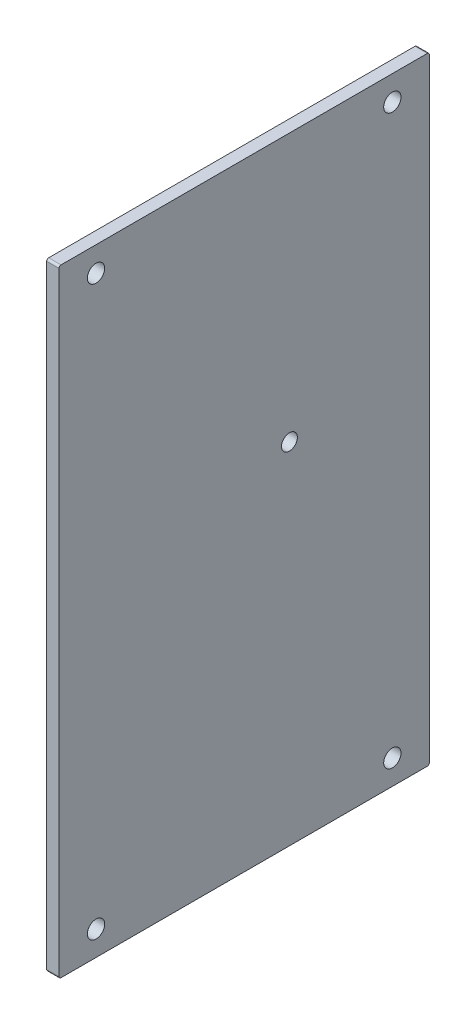
from build123d import *

# Parameters (mm, degrees)
SKETCH1_W           = 90
SKETCH1_H           = 150
SKETCH1_R           = 1.925
SKETCH1_R_2         = 2.1
BOSS_EXTRUDE1_DEPTH = 3
FILLET1_R           = 0.5


with BuildPart() as part:
    # Sketch1 → Boss-Extrude1 (new body)
    with BuildSketch(Plane(origin=(0, 0, 0), x_dir=(0, 0, -1), z_dir=(1, 0, 0))):
        with Locations((45, -75)):
            Rectangle(SKETCH1_W, SKETCH1_H)
        with Locations((56, -65)):
            Circle(SKETCH1_R, mode=Mode.SUBTRACT)
        with Locations((9, -6)):
            Circle(SKETCH1_R_2, mode=Mode.SUBTRACT)
        with Locations(Location((81, -6, 0), (0, 0, 180))):
            Circle(SKETCH1_R_2, mode=Mode.SUBTRACT)
        with Locations((81, -144)):
            Circle(SKETCH1_R_2, mode=Mode.SUBTRACT)
        with Locations(Location((9, -144, 0), (0, 0, 180))):
            Circle(SKETCH1_R_2, mode=Mode.SUBTRACT)
    extrude(amount=BOSS_EXTRUDE1_DEPTH)

    # Fillet1
    fillet1_edges = [part.edges().sort_by_distance(p)[0] for p in [
        (1.5, 0, 0),
        (1.5, 0, -90),
        (1.5, -150, -90),
        (1.5, -150, 0),
    ]]
    fillet(fillet1_edges, radius=FILLET1_R)


solid = part.part
